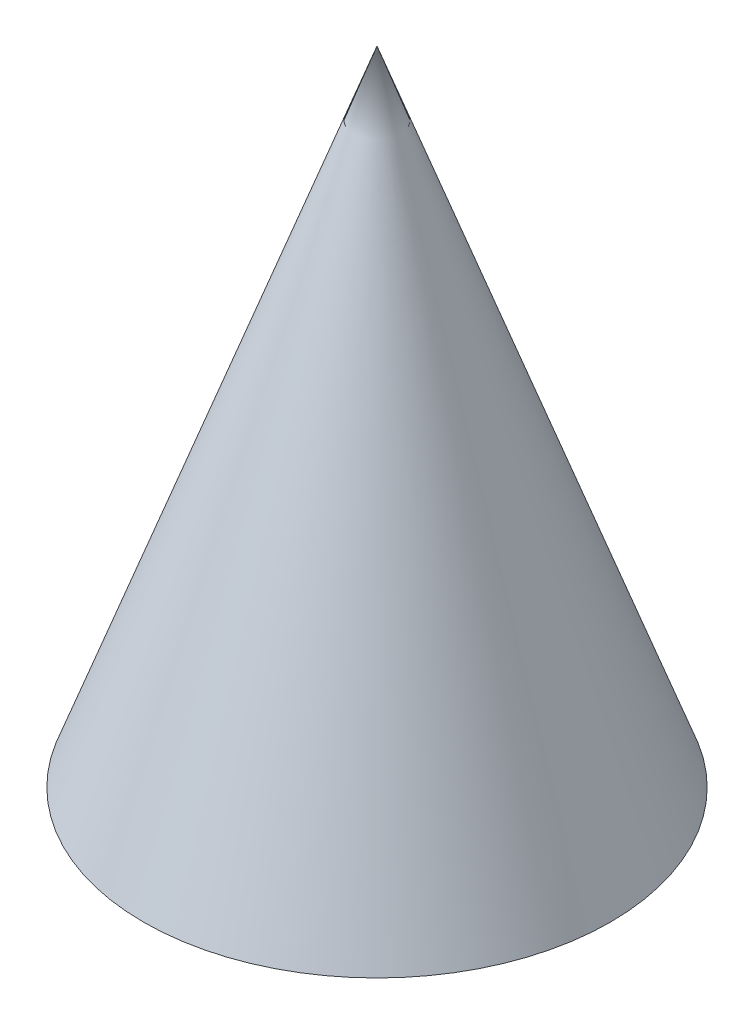
from build123d import *


with BuildPart() as part:
    # Sketch1 → Revolve1 (revolve)
    with BuildSketch(Plane.XY, mode=Mode.PRIVATE) as revolve1_sk:
        Polygon((0, 0), (0, 55), (20, 0), align=None)
    revolve(revolve1_sk.sketch.rotate(Axis((0, 0, 0), (0, 1, 0)), 90), axis=Axis((0, 0, 0), (0, 1, 0)))


solid = part.part
